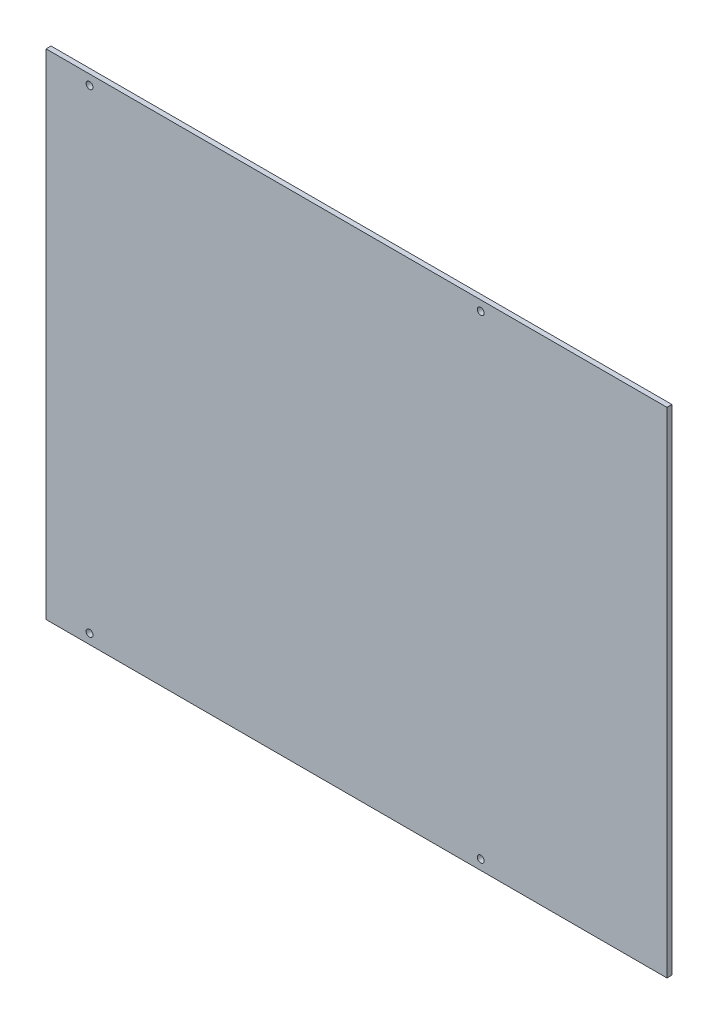
from build123d import *

# Parameters (mm, degrees)
ESQUISSE1_W        = 500
ESQUISSE1_H        = 398
BOSS_EXTRU_1_DEPTH = 4
D_GAGEMENT_M51_D   = 5.5


with BuildPart() as part:
    # Esquisse1 → Boss.-Extru.1 (new body)
    with BuildSketch(Plane.XY):
        Rectangle(ESQUISSE1_W, ESQUISSE1_H)
    extrude(amount=BOSS_EXTRU_1_DEPTH)

    # Dégagement M51 (through all)
    with Locations(Plane(origin=(-215, 191, 4), x_dir=(1, 0, 0), z_dir=(0, 0, 1))):
        with Locations((0, 0), (315, 0), (315, -382), (0, -382)):
            Hole(D_GAGEMENT_M51_D / 2)


solid = part.part
